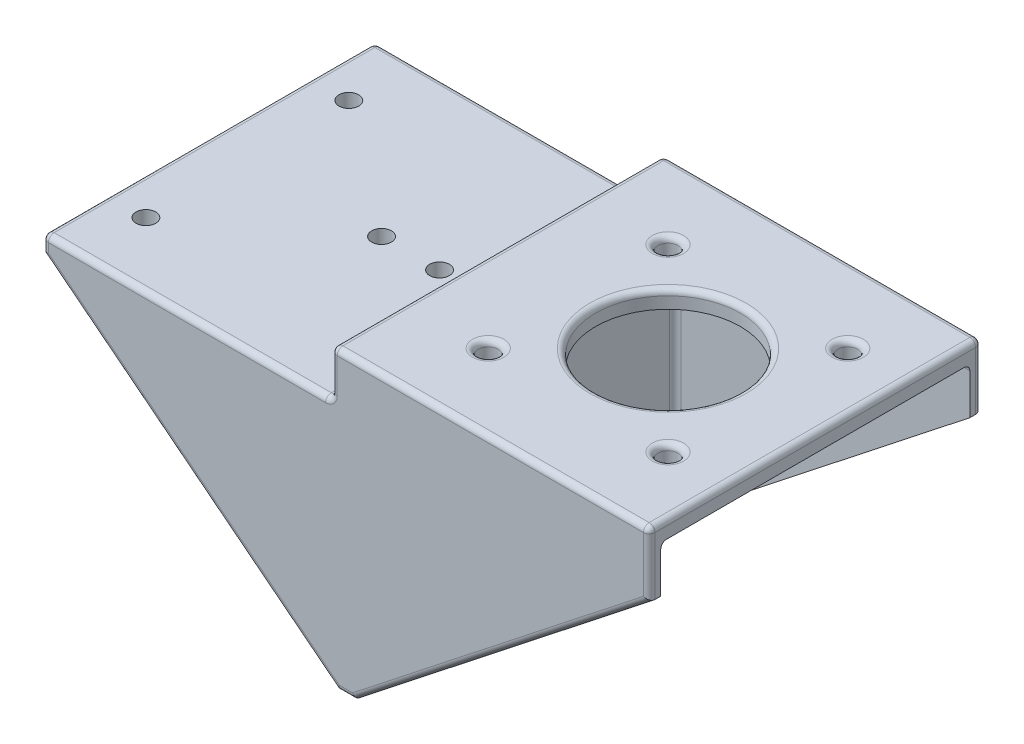
from build123d import *

# Parameters (mm, degrees)
SKETCH1_W            = 104.6
SKETCH1_H            = 57.3
BOSS_EXTRUDE1_DEPTH  = 3
SKETCH3_W            = 3
SKETCH3_H            = 57.3
BOSS_EXTRUDE3_DEPTH  = 40
M3_CLEARANCE_HOLE1_D = 3.4
BOSS_EXTRUDE4_DEPTH  = 2
SKETCH11_R           = 12.5
CUT_EXTRUDE1_DEPTH   = 72.806075648
M3_CLEARANCE_HOLE3_D = 3.4
SKETCH14_R           = 1.7
CUT_EXTRUDE2_DEPTH   = 74.51947021
BOSS_EXTRUDE5_START  = 8
SKETCH16_W           = 50.8
SKETCH16_H           = 57.3
SKETCH16_R           = 12.5
SKETCH16_R_2         = 1.7
BOSS_EXTRUDE5_DEPTH  = 8
SKETCH17_W           = 50.8
SKETCH17_H           = 53.3
CUT_EXTRUDE3_DEPTH   = 8
SKETCH18_W           = 57.3
SKETCH18_H           = 8
BOSS_EXTRUDE6_DEPTH  = 4
FILLET1_R            = 1


with BuildPart() as part:
    # Sketch1 → Boss-Extrude1 (new body)
    with BuildSketch(Plane(origin=(0, 0, 0), x_dir=(1, 0, 0), z_dir=(0, 1, 0))):
        Rectangle(SKETCH1_W, SKETCH1_H)
    extrude(amount=BOSS_EXTRUDE1_DEPTH)

    # Sketch3 → Boss-Extrude3 (add)
    with BuildSketch(Plane.XZ):
        Rectangle(SKETCH3_W, SKETCH3_H)
    extrude(amount=BOSS_EXTRUDE3_DEPTH)

    # M3 Clearance Hole1 (through all)
    with Locations(Plane(origin=(0, 0, 0), x_dir=(-1, 0, 0), z_dir=(0, -1, 0))):
        with Locations((-11.4, -15.5), (-42.4, 15.5), (-42.4, -15.5), (-11.4, 15.5)):
            Hole(M3_CLEARANCE_HOLE1_D / 2)

    # Sketch10 → Boss-Extrude4 (add)
    with BuildSketch(Plane.XY.offset(28.65)):
        Polygon((-52.3, 0), (-1.5, -40), (-1.5, 0), align=None)
        Polygon((1.5, -40), (52.3, 0), (1.5, 0), align=None)
    boss_extrude4 = extrude(amount=-BOSS_EXTRUDE4_DEPTH)

    # Mirror1: Boss-Extrude4 across plane
    add(boss_extrude4.mirror(Plane(origin=(0, 0, 0), x_dir=(1, 0, 0), z_dir=(0, 0, -1))))

    # Sketch11 → Cut-Extrude1 (cut, through all)
    with BuildSketch(Plane.XZ):
        with Locations(Location((26.9, 0, 0), (0, 0, 270))):
            Circle(SKETCH11_R)
    extrude(amount=-CUT_EXTRUDE1_DEPTH, mode=Mode.SUBTRACT)

    # M3 Clearance Hole3 (through all)
    with Locations(Plane(origin=(0, 0, 0), x_dir=(-1, 0, 0), z_dir=(0, -1, 0))):
        with Locations((45.638207547, -17.5), (8.161792453, 17.5), (8.161792453, -17.5), (45.638207547, 17.5)):
            Hole(M3_CLEARANCE_HOLE3_D / 2)

    # Sketch14 → Cut-Extrude2 (cut, through all)
    with BuildSketch(Plane(origin=(0, 3, 0), x_dir=(1, 0, 0), z_dir=(0, 1, 0))):
        with Locations(Location((-22.5, 4e-09, 0), (0, 0, 270))):
            Circle(SKETCH14_R)
        with Locations(Location((-12.5, 4e-09, 0), (0, 0, 270))):
            Circle(SKETCH14_R)
    extrude(amount=-CUT_EXTRUDE2_DEPTH, mode=Mode.SUBTRACT)

    # Sketch16 → Boss-Extrude5 (add)
    with BuildSketch(Plane(origin=(0, 3, 0), x_dir=(1, 0, 0), z_dir=(0, 1, 0)).offset(BOSS_EXTRUDE5_START)):
        with Locations((26.9, 0)):
            Rectangle(SKETCH16_W, SKETCH16_H)
        with Locations(Location((26.9, 0, 0), (0, 0, 90))):
            Circle(SKETCH16_R, mode=Mode.SUBTRACT)
        with Locations(Location((42.4, 15.5, 0), (0, 0, 90))):
            Circle(SKETCH16_R_2, mode=Mode.SUBTRACT)
        with Locations(Location((42.4, -15.5, 0), (0, 0, 90))):
            Circle(SKETCH16_R_2, mode=Mode.SUBTRACT)
        with Locations(Location((11.4, -15.5, 0), (0, 0, 90))):
            Circle(SKETCH16_R_2, mode=Mode.SUBTRACT)
        with Locations(Location((11.4, 15.5, 0), (0, 0, 90))):
            Circle(SKETCH16_R_2, mode=Mode.SUBTRACT)
    extrude(amount=-BOSS_EXTRUDE5_DEPTH)

    # Sketch17 → Cut-Extrude3 (cut)
    with BuildSketch(Plane.XZ):
        with Locations((26.9, 0)):
            Rectangle(SKETCH17_W, SKETCH17_H)
    extrude(amount=-CUT_EXTRUDE3_DEPTH, mode=Mode.SUBTRACT)

    # Sketch18 → Boss-Extrude6 (add)
    with BuildSketch(Plane.ZY.offset(-1.5)):
        with Locations((0, 7)):
            Rectangle(SKETCH18_W, SKETCH18_H)
    extrude(amount=BOSS_EXTRUDE6_DEPTH)

    # Fillet1
    fillet1_edges = [part.edges().sort_by_distance(p)[0] for p in [
        (52.3, 11, 0),
        (24.9, 11, -28.65),
        (24.9, 11, 28.65),
        (-52.3, 3, 0),
        (26.9, 11, 12.5),
        (42.4, 11, -13.8),
        (42.4, 11, 17.2),
        (11.4, 11, 17.2),
        (11.4, 11, -13.8),
        (26.9, 8, 26.65),
        (26.9, 8, -26.65),
        (-27.4, 3, 28.65),
        (0, -40, -28.65),
        (-27.4, 3, -28.65),
        (-2.5, 7, -28.65),
        (-2.5, 3, 0),
        (-2.5, 7, 28.65),
        (-2.5, 11, 0),
        (0, -40, 28.65),
        (-1.5, 0, 0),
        (-26.9, 0, 26.65),
        (-1.5, -20, 26.65),
        (-26.9, -20, 28.65),
        (1.5, -16, 26.65),
        (26.9, -20, 28.65),
        (-26.9, -20, -28.65),
        (-26.9, 0, -26.65),
        (-1.5, -20, -26.65),
        (52.3, 5.5, 28.65),
        (-52.3, 1.5, 28.65),
        (26.9, -20, -28.65),
        (-52.3, 1.5, -28.65),
        (1.5, -16, -26.65),
        (52.3, 5.5, -28.65),
    ]]
    fillet(fillet1_edges, radius=FILLET1_R)


solid = part.part
